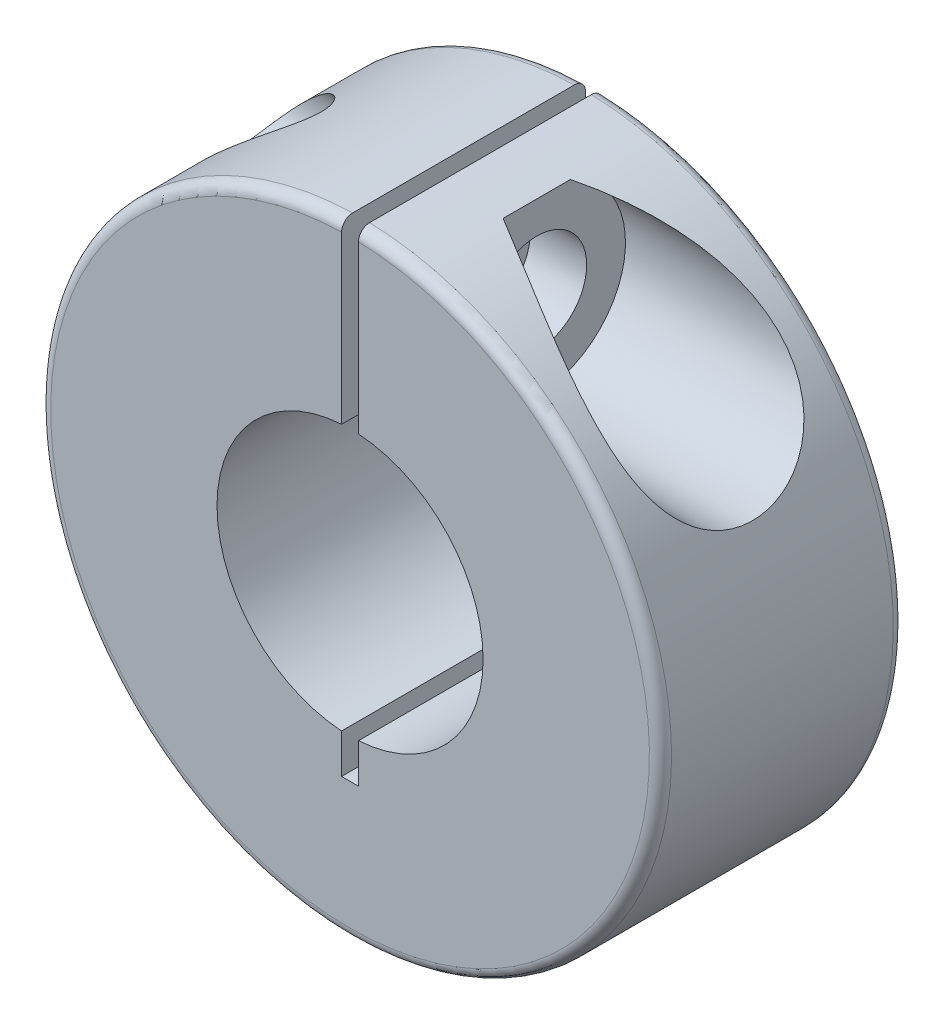
from build123d import *

# Parameters (mm, degrees)
BOSS_EXTRUDE1_DEPTH            = 11
CBORE_FOR_M4_SHCS2_D           = 4.5
CBORE_FOR_M4_SHCS2_CBORE_D     = 8
CBORE_FOR_M4_SHCS2_CBORE_DEPTH = 11.079
FILLET1_R                      = 0.5


with BuildPart() as part:
    # Sketch1 → Boss-Extrude1 (new body)
    with BuildSketch(Plane.XY):
        with BuildLine():
            ThreePointArc((0.381, 5.987891031), (3.163547137, 5.098231998), (5.196152423, 3))
            ThreePointArc((5.196152423, 3), (5.795554958, 1.552914271), (6, 0))
            ThreePointArc((6, 0), (5.795554958, -1.552914271), (5.196152423, -3))
            ThreePointArc((5.196152423, -3), (3.163547137, -5.098231998), (0.381, -5.987891031))
            Line((0.381, -5.987891031), (0.381, -7.765891031))
            Line((0.381, -7.765891031), (-0.381, -7.765891031))
            Line((-0.381, -7.765891031), (-0.381, -5.987891031))
            ThreePointArc((-0.381, -5.987891031), (-6, 0), (-0.381, 5.987891031))
            Line((-0.381, 5.987891031), (-0.381, 13.994814718))
            ThreePointArc((-0.381, 13.994814718), (-9.763861941, -10.033294574), (14, 0))
            ThreePointArc((14, 0), (10.033294574, 9.763861941), (0.381, 13.994814718))
            Line((0.381, 13.994814718), (0.381, 5.987891031))
        make_face()
    extrude(amount=BOSS_EXTRUDE1_DEPTH)

    # CBORE for M4 SHCS2 (through all)
    with Locations(Plane(origin=(14, 0, 0), x_dir=(0, 0, 1), z_dir=(1, 0, 0))):
        with Locations((5.5, -9.991352875)):
            CounterBoreHole(CBORE_FOR_M4_SHCS2_D / 2, CBORE_FOR_M4_SHCS2_CBORE_D / 2, CBORE_FOR_M4_SHCS2_CBORE_DEPTH)

    # Fillet1
    fillet1_edges = [part.edges().sort_by_distance(p)[0] for p in [
        (-9.763861941, -10.033294574, 11),
        (-9.763861941, -10.033294574, 0),
    ]]
    fillet(fillet1_edges, radius=FILLET1_R)


solid = part.part
